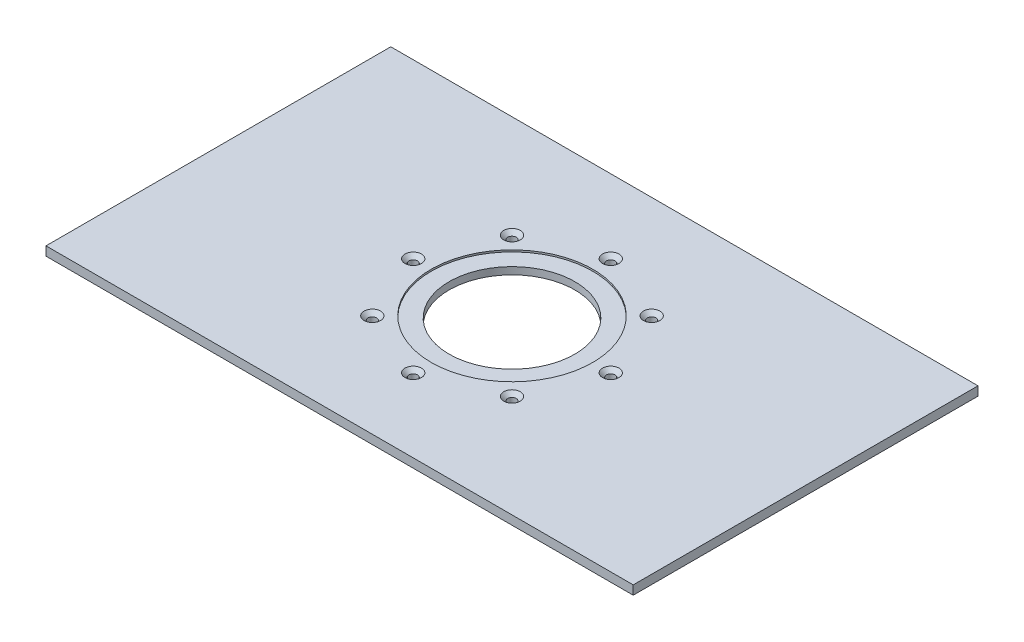
from build123d import *

# Parameters (mm, degrees)
SKETCH1_W                                            = 327
SKETCH1_H                                            = 192
BOSS_EXTRUDE1_DEPTH                                  = 5
SKETCH2_R                                            = 35
CUT_EXTRUDE1_DEPTH                                   = 190.666154071
SKETCH3_R                                            = 45
CUT_EXTRUDE2_DEPTH                                   = 1
CSK_FOR_M4_HEX_SOCKET_COUNTERSUNK_HEAD_S_D           = 4.8
CSK_FOR_M4_HEX_SOCKET_COUNTERSUNK_HEAD_S_CSINK_D     = 9.18
CSK_FOR_M4_HEX_SOCKET_COUNTERSUNK_HEAD_S_CSINK_ANGLE = 90


with BuildPart() as part:
    # Sketch1 → Boss-Extrude1 (new body)
    with BuildSketch(Plane(origin=(0, 0, 0), x_dir=(1, 0, 0), z_dir=(0, 1, 0))):
        Rectangle(SKETCH1_W, SKETCH1_H)
    extrude(amount=BOSS_EXTRUDE1_DEPTH)

    # Sketch2 → Cut-Extrude1 (cut, through all)
    with BuildSketch(Plane(origin=(0, 5, 0), x_dir=(1, 0, 0), z_dir=(0, 1, 0))):
        with Locations(Location((0, 0, 0), (0, 0, 270))):
            Circle(SKETCH2_R)
    extrude(amount=-CUT_EXTRUDE1_DEPTH, mode=Mode.SUBTRACT)

    # Sketch3 → Cut-Extrude2 (cut)
    with BuildSketch(Plane(origin=(0, 5, 0), x_dir=(1, 0, 0), z_dir=(0, 1, 0))):
        with Locations(Location((0, 0, 0), (0, 0, 270))):
            Circle(SKETCH3_R)
    extrude(amount=-CUT_EXTRUDE2_DEPTH, mode=Mode.SUBTRACT)

    # CSK for M4 Hex Socket Countersunk Head Screw1 (through all)
    with Locations(Plane(origin=(0, 5, 0), x_dir=(1, 0, 0), z_dir=(0, 1, 0))):
        with Locations((-38.890872965, -38.890872965), (-55, 0), (-38.890872965, 38.890872965), (0, 55), (38.890872965, 38.890872965), (55, 0), (38.890872965, -38.890872965), (0, -55)):
            CounterSinkHole(CSK_FOR_M4_HEX_SOCKET_COUNTERSUNK_HEAD_S_D / 2, CSK_FOR_M4_HEX_SOCKET_COUNTERSUNK_HEAD_S_CSINK_D / 2, counter_sink_angle=CSK_FOR_M4_HEX_SOCKET_COUNTERSUNK_HEAD_S_CSINK_ANGLE)


solid = part.part
